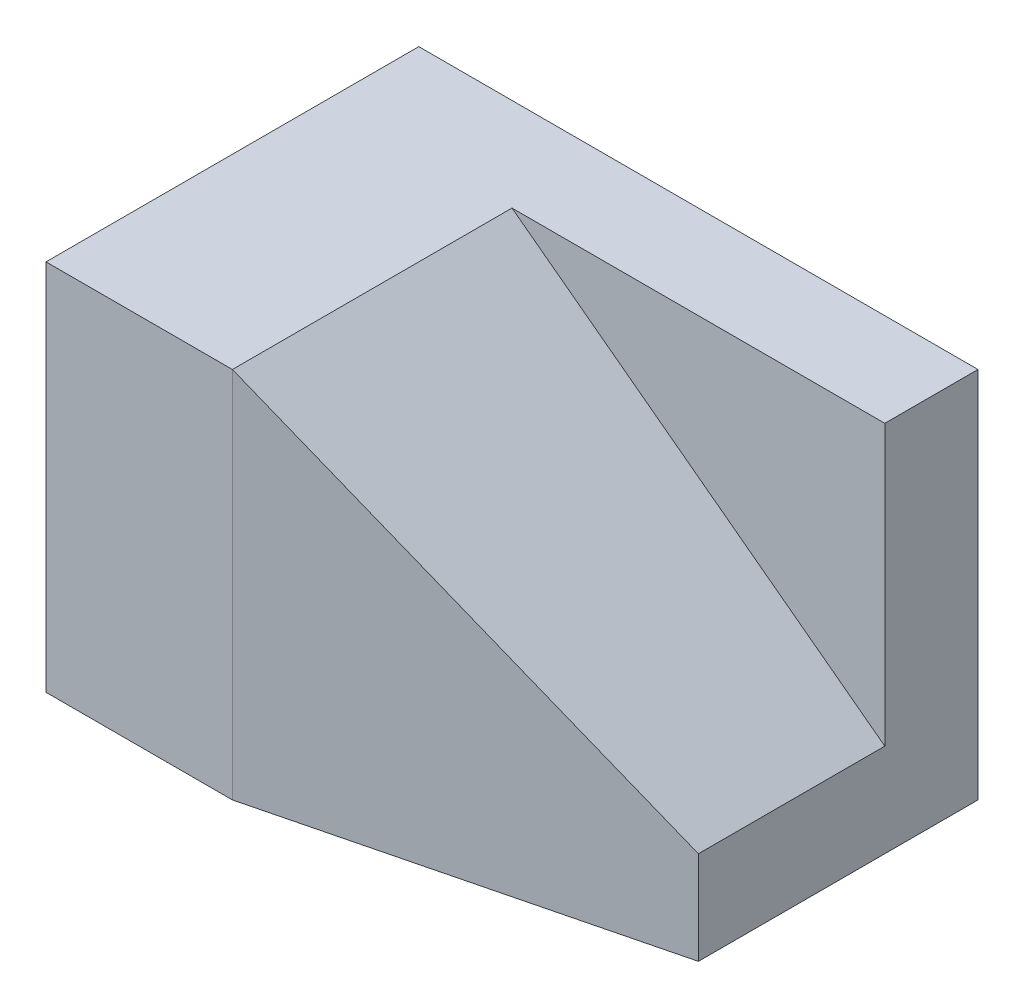
from build123d import *

# Parameters (mm, degrees)
BOSS_EXTRUDE1_DEPTH = 40


with BuildPart() as part:
    # Sketch1 → Boss-Extrude1 (new body)
    with BuildSketch(Plane(origin=(0, 0, 0), x_dir=(1, 0, 0), z_dir=(0, 1, 0))):
        Polygon((-29.639344262, 22.68852459), (-29.639344262, -17.31147541), (-9.639344262, -17.31147541), (-9.639344262, 12.68852459), (30.360655738, 12.68852459), (30.360655738, 22.68852459), align=None)
    extrude(amount=BOSS_EXTRUDE1_DEPTH)

    # Sketch3 → Loft1 section 0
    with BuildSketch(Plane(origin=(30.360655738, 0, 0), x_dir=(0, 0, -1), z_dir=(1, 0, 0))):
        with BuildLine():
            Line((12.68852459, 0), (-7.31147541, 0))
            Line((-7.31147541, 0), (-7.31147541, 10))
            Line((-7.31147541, 10), (12.68852459, 10))
            Line((12.68852459, 10), (12.68852459, 0))
        make_face()
    # Sketch2 → Loft1 section 1
    with BuildSketch(Plane(origin=(-9.639344262, 0, 0), x_dir=(0, 0, -1), z_dir=(1, 0, 0))):
        with BuildLine():
            Line((-17.31147541, 40), (12.68852459, 40))
            Line((12.68852459, 40), (12.68852459, 0))
            Line((12.68852459, 0), (-17.31147541, 0))
            Line((-17.31147541, 0), (-17.31147541, 40))
        make_face()
    loft()


solid = part.part
